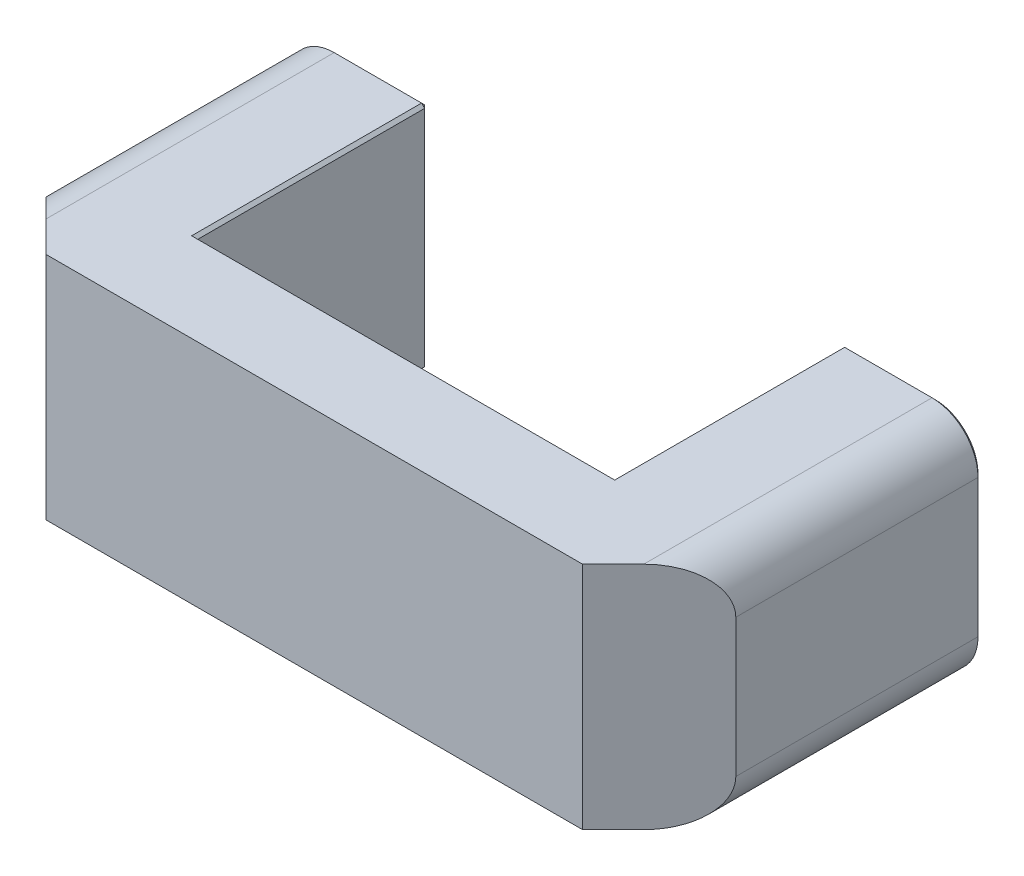
from build123d import *

# Parameters (mm, degrees)
BOSS_EXTRUDE1_DEPTH       = 30
CHAMFER1_SIZE             = 10
FILLET1_R                 = 6
F_5_0MM_DOWEL_HOLE1_D     = 5
F_5_0MM_DOWEL_HOLE1_DEPTH = 12
F_5_0MM_DOWEL_HOLE1_TIP   = 1.502151548
CHAMFER2_SIZE             = 0.4


with BuildPart() as part:
    # Sketch1 → Boss-Extrude1 (new body)
    with BuildSketch(Plane(origin=(0, 0, 0), x_dir=(1, 0, 0), z_dir=(0, 1, 0))):
        Polygon((-45, 30), (-45, -12), (45, -12), (45, 30), (27.2, 30), (27.2, 0), (-27.2, 0), (-27.2, 30), align=None)
    extrude(amount=BOSS_EXTRUDE1_DEPTH)

    # Chamfer1
    chamfer1_edges = [part.edges().sort_by_distance(p)[0] for p in [
        (45, 15, 12),
        (-45, 15, 12),
    ]]
    chamfer(chamfer1_edges, length=CHAMFER1_SIZE)

    # Fillet1
    fillet1_edges = [part.edges().sort_by_distance(p)[0] for p in [
        (-45, 0, -14),
        (45, 0, -14),
        (45, 30, -14),
        (-45, 30, -14),
    ]]
    fillet(fillet1_edges, radius=FILLET1_R)

    # Ø5.0mm Dowel Hole1
    with Locations(Plane(origin=(0, 0, -30), x_dir=(-1, 0, 0), z_dir=(0, 0, -1))):
        with Locations((-36.1, 7.5), (36.1, 22.5), (36.1, 7.5), (-36.1, 22.5)):
            Hole(F_5_0MM_DOWEL_HOLE1_D / 2, depth=F_5_0MM_DOWEL_HOLE1_DEPTH)
            with Locations((0, 0, -(F_5_0MM_DOWEL_HOLE1_DEPTH + F_5_0MM_DOWEL_HOLE1_TIP / 2))):  # 118° drill point
                Cone(0, F_5_0MM_DOWEL_HOLE1_D / 2, F_5_0MM_DOWEL_HOLE1_TIP, mode=Mode.SUBTRACT)

    # Chamfer2
    chamfer2_edges = [part.edges().sort_by_distance(p)[0] for p in [
        (-33.1, 0, -30),
        (-27.2, 15, -30),
        (27.2, 15, -30),
        (27.2, 30, -15),
        (0, 30, 0),
        (-27.2, 30, -15),
        (33.1, 30, -30),
        (-45, 15, -30),
        (-43.242640687, 1.757359313, -30),
        (-43.242640687, 28.242640687, -30),
        (33.1, 0, -30),
        (45, 15, -30),
        (43.242640687, 1.757359313, -30),
        (-33.1, 30, -30),
        (43.242640687, 28.242640687, -30),
        (33.6, 7.5, -30),
        (33.6, 22.5, -30),
        (-38.6, 7.5, -30),
        (-38.6, 22.5, -30),
        (-27.2, 0, -15),
        (0, 0, 0),
        (27.2, 0, -15),
    ]]
    chamfer(chamfer2_edges, length=CHAMFER2_SIZE)


solid = part.part
